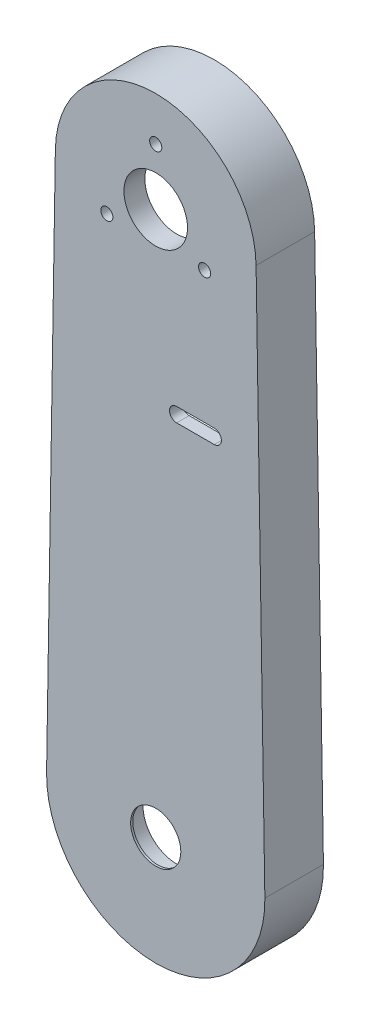
from build123d import *

# Parameters (mm, degrees)
SKETCH1_R           = 6
SKETCH1_R_2         = 1.45
BOSS_EXTRUDE1_DEPTH = 3
SKETCH2_R           = 20
SKETCH2_R_2         = 1.45
BOSS_EXTRUDE2_DEPTH = 2
SKETCH3_R           = 12
SKETCH3_R_2         = 6
BOSS_EXTRUDE3_DEPTH = 2
BOSS_EXTRUDE4_DEPTH = 11
SKETCH5_R           = 5.05
BOSS_EXTRUDE5_DEPTH = 11
SKETCH6_R           = 5.05
BOSS_EXTRUDE6_DEPTH = 11
SKETCH7_R           = 5.05
BOSS_EXTRUDE7_DEPTH = 11
SKETCH8_R           = 5.05
BOSS_EXTRUDE8_DEPTH = 11
SKETCH9_R           = 2.05
CUT_EXTRUDE1_DEPTH  = 6.7
SKETCH10_R          = 7.6
CUT_EXTRUDE2_DEPTH  = 5
SKETCH11_R          = 8.05
CUT_EXTRUDE3_DEPTH  = 4.5


with BuildPart() as part:
    # Sketch1 → Boss-Extrude1 (new body)
    with BuildSketch(Plane.XY.offset(344.5)):
        with BuildLine():
            Line((276.003127371, 300.387432585), (273.904807661, 170.421310226))
            ThreePointArc((273.904807661, 170.421310226), (300, 143.901406829), (326.095192339, 170.421310226))
            Line((326.095192339, 170.421310226), (323.996872629, 300.387432585))
            ThreePointArc((323.996872629, 300.387432585), (300, 324), (276.003127371, 300.387432585))
        make_face()
        with Locations((300, 170)):
            Circle(SKETCH1_R, mode=Mode.SUBTRACT)
        with Locations((300, 313.5)):
            Circle(SKETCH1_R_2, mode=Mode.SUBTRACT)
        with Locations((288.308657049, 293.25)):
            Circle(SKETCH1_R_2, mode=Mode.SUBTRACT)
        with Locations((311.691342951, 293.25)):
            Circle(SKETCH1_R_2, mode=Mode.SUBTRACT)
        with BuildLine():
            Line((305, 258.3), (314, 258.3))
            ThreePointArc((314, 258.3), (315.7, 260), (314, 261.7))
            Line((314, 261.7), (305, 261.7))
            ThreePointArc((305, 261.7), (303.3, 260), (305, 258.3))
        make_face(mode=Mode.SUBTRACT)
    extrude(amount=BOSS_EXTRUDE1_DEPTH)

    # Sketch2 → Boss-Extrude2 (add)
    with BuildSketch(Plane.XY.offset(342.5)):
        with Locations((300, 300)):
            Circle(SKETCH2_R)
        with Locations((300, 313.5)):
            Circle(SKETCH2_R_2, mode=Mode.SUBTRACT)
        with Locations((288.308657049, 293.25)):
            Circle(SKETCH2_R_2, mode=Mode.SUBTRACT)
        with Locations((311.691342951, 293.25)):
            Circle(SKETCH2_R_2, mode=Mode.SUBTRACT)
    extrude(amount=BOSS_EXTRUDE2_DEPTH)

    # Sketch3 → Boss-Extrude3 (add)
    with BuildSketch(Plane.XY.offset(342.5)):
        with Locations((300, 170)):
            Circle(SKETCH3_R)
        with Locations((300, 170)):
            Circle(SKETCH3_R_2, mode=Mode.SUBTRACT)
    extrude(amount=BOSS_EXTRUDE3_DEPTH)

    # Sketch4 → Boss-Extrude4 (add)
    with BuildSketch(Plane.XY.offset(333.5)):
        with BuildLine():
            Line((276.003127371, 300.387432585), (273.904807661, 170.421310226))
            ThreePointArc((273.904807661, 170.421310226), (300, 143.901406829), (326.095192339, 170.421310226))
            Line((326.095192339, 170.421310226), (323.996872629, 300.387432585))
            ThreePointArc((323.996872629, 300.387432585), (300, 324), (276.003127371, 300.387432585))
        make_face()
        with BuildLine():
            Line((282.510952348, 300.619041388), (277.9152372, 170.781711074))
            ThreePointArc((277.9152372, 170.781711074), (300, 147.901406829), (322.0847628, 170.781711074))
            Line((322.0847628, 170.781711074), (317.489047652, 300.619041388))
            ThreePointArc((317.489047652, 300.619041388), (300, 317.5), (282.510952348, 300.619041388))
        make_face(mode=Mode.SUBTRACT)
    extrude(amount=BOSS_EXTRUDE4_DEPTH)

    # Sketch5 → Boss-Extrude5 (add)
    with BuildSketch(Plane.XY.offset(333.5)):
        with Locations((314.289419162, 308.25)):
            Circle(SKETCH5_R)
    extrude(amount=BOSS_EXTRUDE5_DEPTH)

    # Sketch6 → Boss-Extrude6 (add)
    with BuildSketch(Plane.XY.offset(333.5)):
        with Locations((285.710580838, 308.25)):
            Circle(SKETCH6_R)
    extrude(amount=BOSS_EXTRUDE6_DEPTH)

    # Sketch7 → Boss-Extrude7 (add)
    with BuildSketch(Plane.XY.offset(333.5)):
        with Locations((300, 240)):
            Circle(SKETCH7_R)
    extrude(amount=BOSS_EXTRUDE7_DEPTH)

    # Sketch8 → Boss-Extrude8 (add)
    with BuildSketch(Plane.XY.offset(333.5)):
        with Locations((300, 200)):
            Circle(SKETCH8_R)
    extrude(amount=BOSS_EXTRUDE8_DEPTH)

    # Sketch9 → Cut-Extrude1 (cut)
    with BuildSketch(Plane.XY.offset(333.5)):
        with Locations((314.289419162, 308.25)):
            Circle(SKETCH9_R)
        with Locations((285.710580838, 308.25)):
            Circle(SKETCH9_R)
        with Locations((300, 240)):
            Circle(SKETCH9_R)
        with Locations((300, 200)):
            Circle(SKETCH9_R)
    extrude(amount=CUT_EXTRUDE1_DEPTH, mode=Mode.SUBTRACT)

    # Sketch10 → Cut-Extrude2 (cut)
    with BuildSketch(Plane.XY.offset(342.5)):
        with Locations((300, 300)):
            Circle(SKETCH10_R)
    extrude(amount=CUT_EXTRUDE2_DEPTH, mode=Mode.SUBTRACT)

    # Sketch11 → Cut-Extrude3 (cut)
    with BuildSketch(Plane.XY.offset(342.5)):
        with Locations((300, 170)):
            Circle(SKETCH11_R)
    extrude(amount=CUT_EXTRUDE3_DEPTH, mode=Mode.SUBTRACT)


solid = part.part
